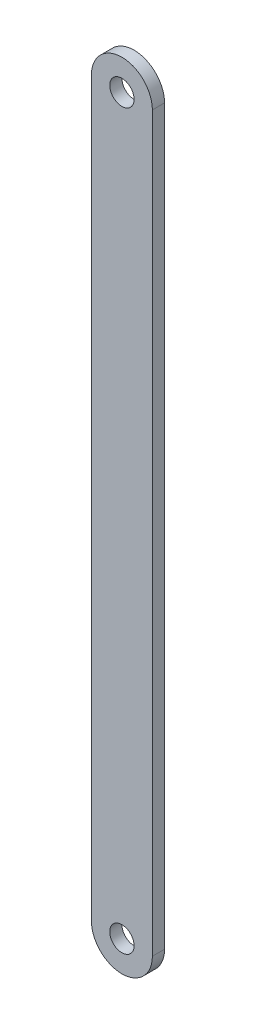
from build123d import *

# Parameters (mm, degrees)
CROQUIS1_R              = 10
SALIENTE_EXTRUIR1_DEPTH = 10


with BuildPart() as part:
    # Croquis1 → Saliente-Extruir1 (new body)
    with BuildSketch(Plane.XY):
        with BuildLine():
            Line((50, 0), (50, 601.7))
            ThreePointArc((50, 601.7), (25, 626.7), (0, 601.7))
            Line((0, 601.7), (0, 0))
            ThreePointArc((0, 0), (25, -25), (50, 0))
        make_face()
        with Locations((25, 601.7)):
            Circle(CROQUIS1_R, mode=Mode.SUBTRACT)
        with Locations((25, 0)):
            Circle(CROQUIS1_R, mode=Mode.SUBTRACT)
    extrude(amount=SALIENTE_EXTRUIR1_DEPTH)


solid = part.part
